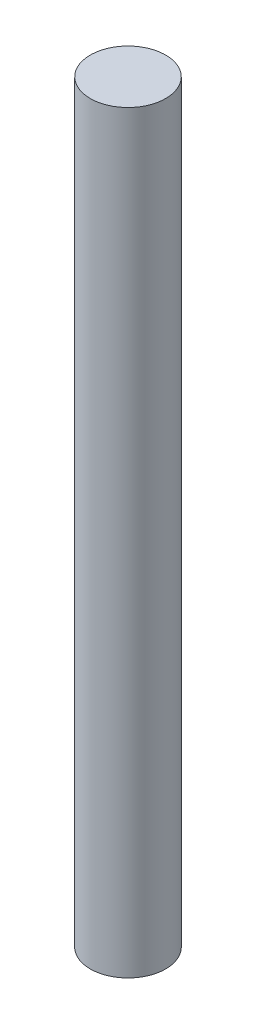
from build123d import *

# Parameters (mm, degrees)
SKETCH1_R           = 2.5
BOSS_EXTRUDE2_DEPTH = 50


with BuildPart() as part:
    # Sketch1 → Boss-Extrude2 (new body)
    with BuildSketch(Plane(origin=(0, 0, 0), x_dir=(1, 0, 0), z_dir=(0, 1, 0))):
        with Locations(Location((0, 0, 0), (0, 0, 270))):
            Circle(SKETCH1_R)
    extrude(amount=BOSS_EXTRUDE2_DEPTH)


solid = part.part
